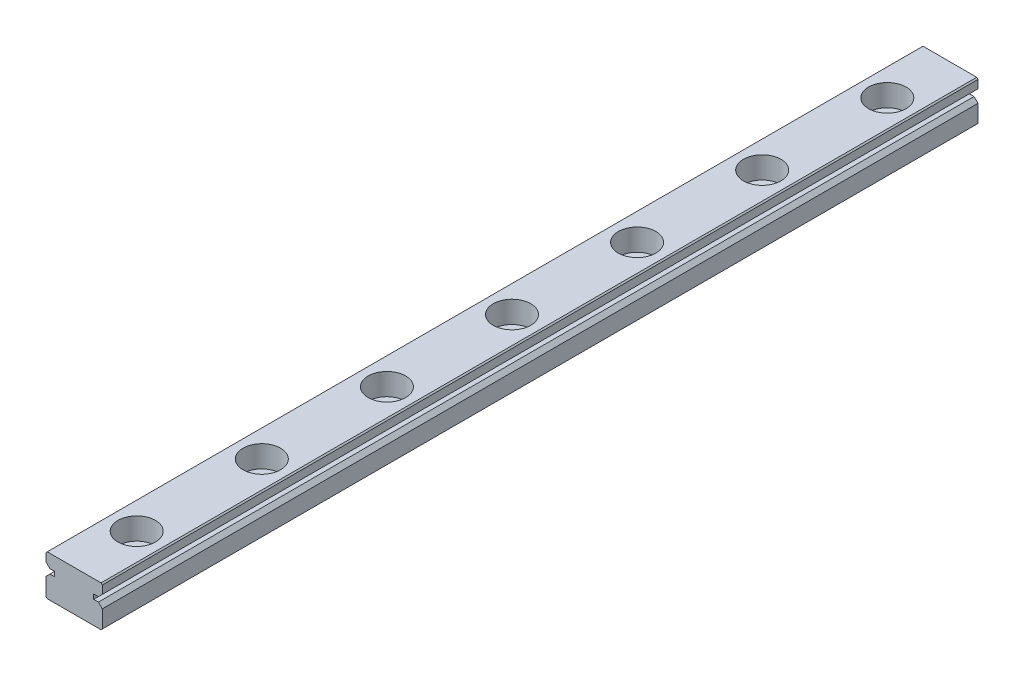
from build123d import *

# Parameters (mm, degrees)
EXTRUDE_1_DEPTH           = 140
HOLE_WIZARD_1_D           = 3.5
HOLE_WIZARD_1_CBORE_D     = 6
HOLE_WIZARD_1_CBORE_DEPTH = 3.5
PATTERN_LINEAR_1_COUNT    = 7
PATTERN_LINEAR_1_PITCH    = 20


with BuildPart() as part:
    # 草图1 → 凸台-拉伸1 (new body)
    with BuildSketch(Plane.XY):
        Polygon((4.3, 0), (4.5, 0.2), (4.5, 3), (3.875, 3.625), (3.125, 3.625), (3.125, 4.375), (3.875, 4.375), (4.5, 5), (4.5, 6.3), (4.3, 6.5), (-4.3, 6.5), (-4.5, 6.3), (-4.5, 5), (-3.875, 4.375), (-3.125, 4.375), (-3.125, 3.625), (-3.875, 3.625), (-4.5, 3), (-4.5, 0.2), (-4.3, 0), align=None)
    extrude(amount=EXTRUDE_1_DEPTH)

    # 打孔尺寸(%根据)内六角圆柱头螺钉的类型1 (through all)
    with Locations(Plane(origin=(0, 6.5, 0), x_dir=(1, 0, 0), z_dir=(0, 1, 0))):
        with Locations((0, -10)):
            hole_wizard_1 = CounterBoreHole(HOLE_WIZARD_1_D / 2, HOLE_WIZARD_1_CBORE_D / 2, HOLE_WIZARD_1_CBORE_DEPTH)

    # 阵列(线性)1: 打孔尺寸(%根据)内六角圆柱头螺钉的类型1 ×7
    with Locations(*[(0, 0, i * PATTERN_LINEAR_1_PITCH) for i in range(1, PATTERN_LINEAR_1_COUNT)]):
        add(hole_wizard_1, mode=Mode.SUBTRACT)


solid = part.part
